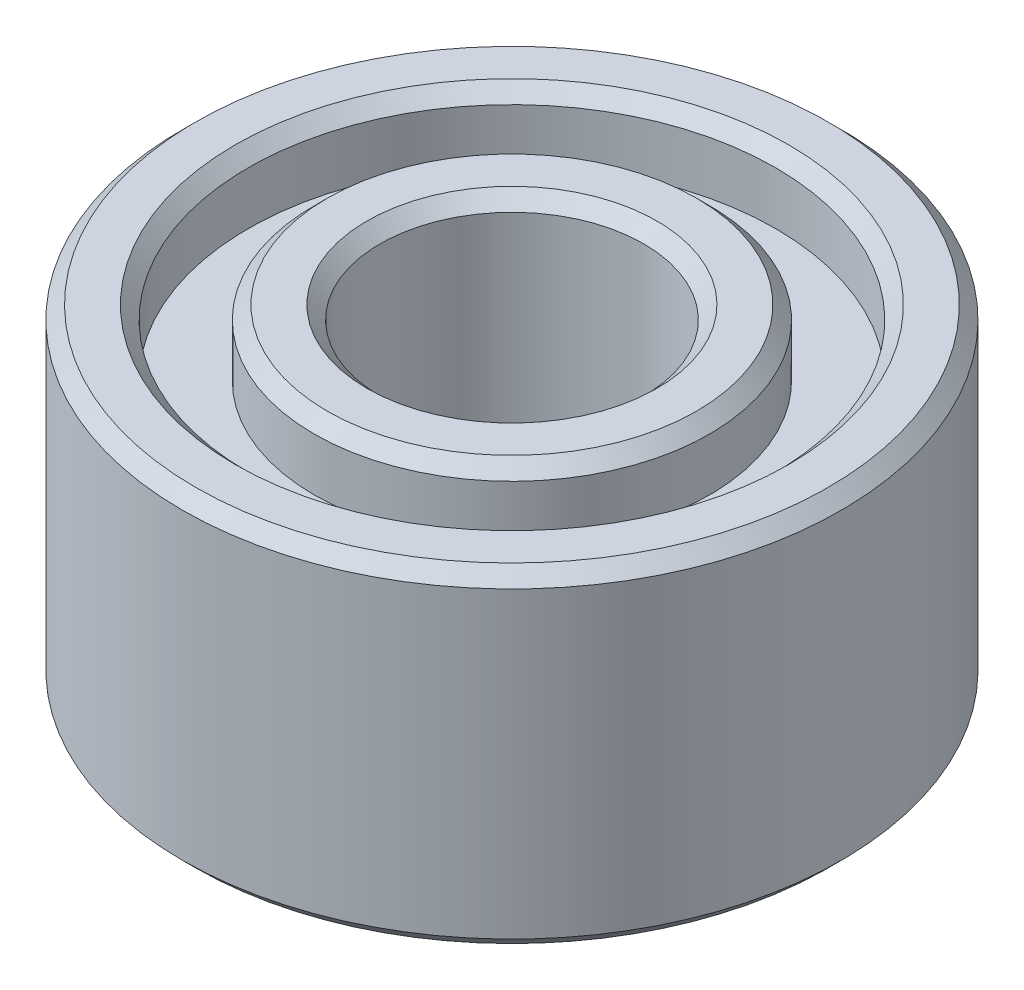
from build123d import *

# Parameters (mm, degrees)
SKETCH1_R           = 2.5
SKETCH1_R_2         = 1
BOSS_EXTRUDE1_DEPTH = 2.5
SKETCH2_R           = 2
SKETCH2_R_2         = 1.5
CUT_EXTRUDE1_DEPTH  = 0.5
CUT_EXTRUDE2_START  = -0.5
SKETCH3_R           = 2
SKETCH3_R_2         = 1.5
CUT_EXTRUDE2_DEPTH  = 0.5
CHAMFER1_SIZE       = 0.1


with BuildPart() as part:
    # Sketch1 → Boss-Extrude1 (new body)
    with BuildSketch(Plane(origin=(0, 0, 0), x_dir=(1, 0, 0), z_dir=(0, 1, 0))):
        with Locations(Location((0, 0, 0), (0, 0, 270))):
            Circle(SKETCH1_R)
        with Locations(Location((0, 0, 0), (0, 0, 270))):
            Circle(SKETCH1_R_2, mode=Mode.SUBTRACT)
    extrude(amount=BOSS_EXTRUDE1_DEPTH)

    # Sketch2 → Cut-Extrude1 (cut)
    with BuildSketch(Plane(origin=(0, 2.5, 0), x_dir=(1, 0, 0), z_dir=(0, 1, 0))):
        with Locations(Location((0, 0, 0), (0, 0, 270))):
            Circle(SKETCH2_R)
        with Locations(Location((0, 0, 0), (0, 0, 270))):
            Circle(SKETCH2_R_2, mode=Mode.SUBTRACT)
    extrude(amount=-CUT_EXTRUDE1_DEPTH, mode=Mode.SUBTRACT)

    # Sketch3 → Cut-Extrude2 (cut)
    with BuildSketch(Plane.XZ.offset(CUT_EXTRUDE2_START)):
        with Locations(Location((0, 0, 0), (0, 0, 90))):
            Circle(SKETCH3_R)
        with Locations(Location((0, 0, 0), (0, 0, 90))):
            Circle(SKETCH3_R_2, mode=Mode.SUBTRACT)
    extrude(amount=CUT_EXTRUDE2_DEPTH, mode=Mode.SUBTRACT)

    # Chamfer1
    chamfer1_edges = [part.edges().sort_by_distance(p)[0] for p in [
        (0, 2.5, -2),
        (0, 2.5, -1.5),
        (0, 0, -2),
        (0, 0, -2.5),
        (0, 2.5, -2.5),
        (0, 2.5, -1),
    ]]
    chamfer(chamfer1_edges, length=CHAMFER1_SIZE)


solid = part.part
